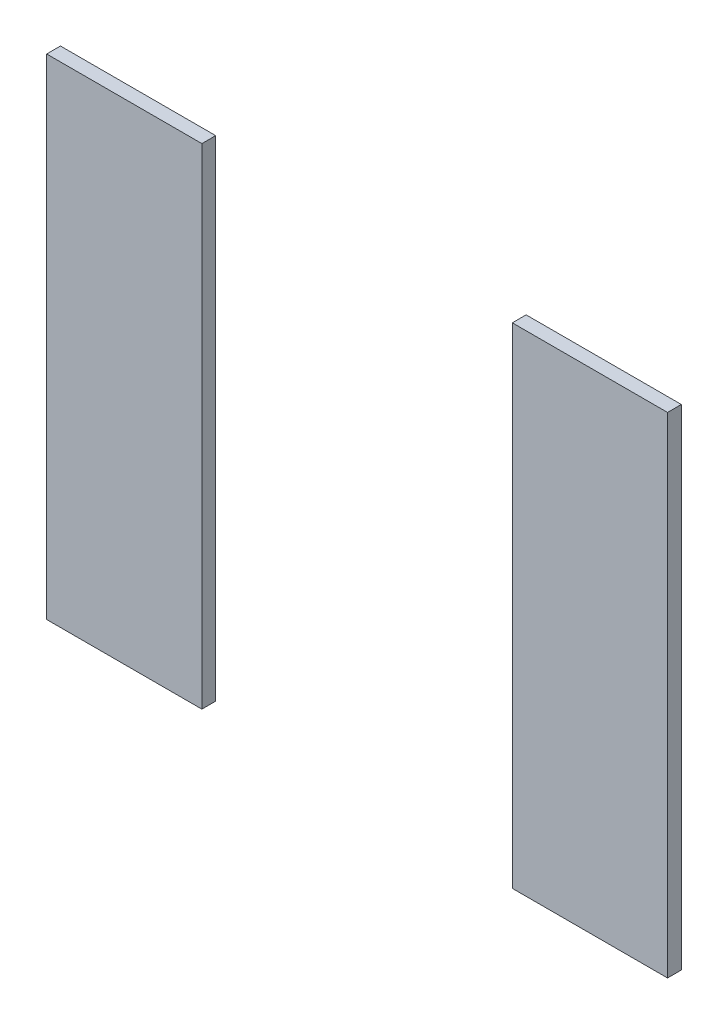
from build123d import *

# Parameters (mm, degrees)
SKETCH2_W             = 225
SKETCH2_H             = 710
BOSS_EXTRUDE1_DEPTH   = 10
BOSS_EXTRUDE1_2_DEPTH = 10


with BuildPart() as part:
    # Sketch2 → Boss-Extrude1 (new, symmetric)
    with BuildSketch(Plane.XY):
        with Locations((-337.5, -355)):
            Rectangle(SKETCH2_W, SKETCH2_H)
    extrude(amount=BOSS_EXTRUDE1_DEPTH, both=True)


with BuildPart() as body_2:
    # Sketch2 → Boss-Extrude1 2 (new, symmetric)
    with BuildSketch(Plane.XY):
        with Locations((337.5, -355)):
            Rectangle(SKETCH2_W, SKETCH2_H)
    extrude(amount=BOSS_EXTRUDE1_2_DEPTH, both=True)


solid = Compound([part.part, body_2.part])
